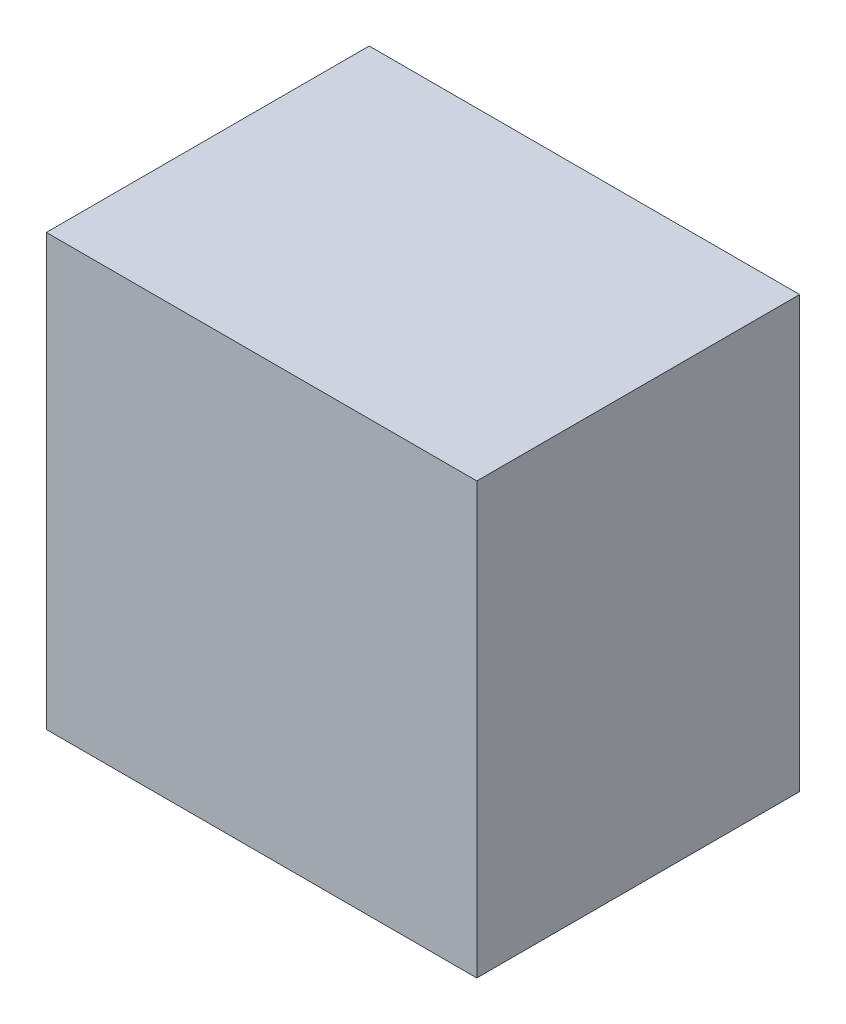
from build123d import *

# Parameters (mm, degrees)
OVEN_PANO_PLC_1_START = -173
SKETCH1_W             = 100
SKETCH1_H             = 100
OVEN_PANO_PLC_1_DEPTH = 75


with BuildPart() as part:
    # Sketch1 → OVEN_pano_plc_1 (new body)
    with BuildSketch(Plane.XY.offset(OVEN_PANO_PLC_1_START)):
        with Locations((110, 250)):
            Rectangle(SKETCH1_W, SKETCH1_H)
    extrude(amount=-OVEN_PANO_PLC_1_DEPTH)


solid = part.part
